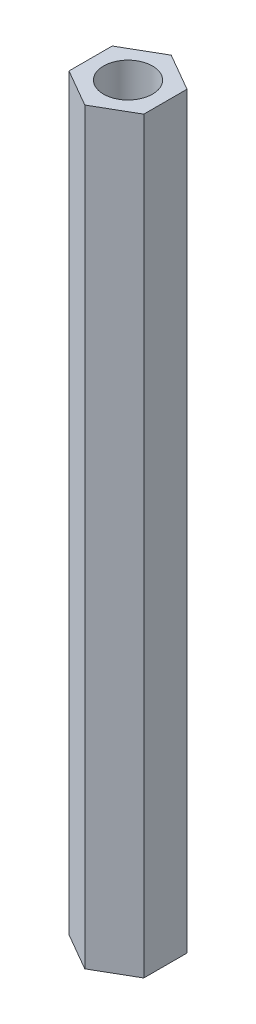
from build123d import *

# Parameters (mm, degrees)
SKETCH1_R           = 1.635
BOSS_EXTRUDE1_DEPTH = 50


with BuildPart() as part:
    # Sketch1 → Boss-Extrude1 (new body)
    with BuildSketch(Plane(origin=(0, 0, 0), x_dir=(1, 0, 0), z_dir=(0, 1, 0))):
        Polygon((2.500215268, 1.443500126), (2.500215413, -1.443499874), (1.45e-07, -2.887), (-2.500215268, -1.443500126), (-2.500215413, 1.443499874), (-1.45e-07, 2.887), align=None)
        with Locations(Location((0, 0, 0), (0, 0, 270))):
            Circle(SKETCH1_R, mode=Mode.SUBTRACT)
    extrude(amount=BOSS_EXTRUDE1_DEPTH)


solid = part.part
